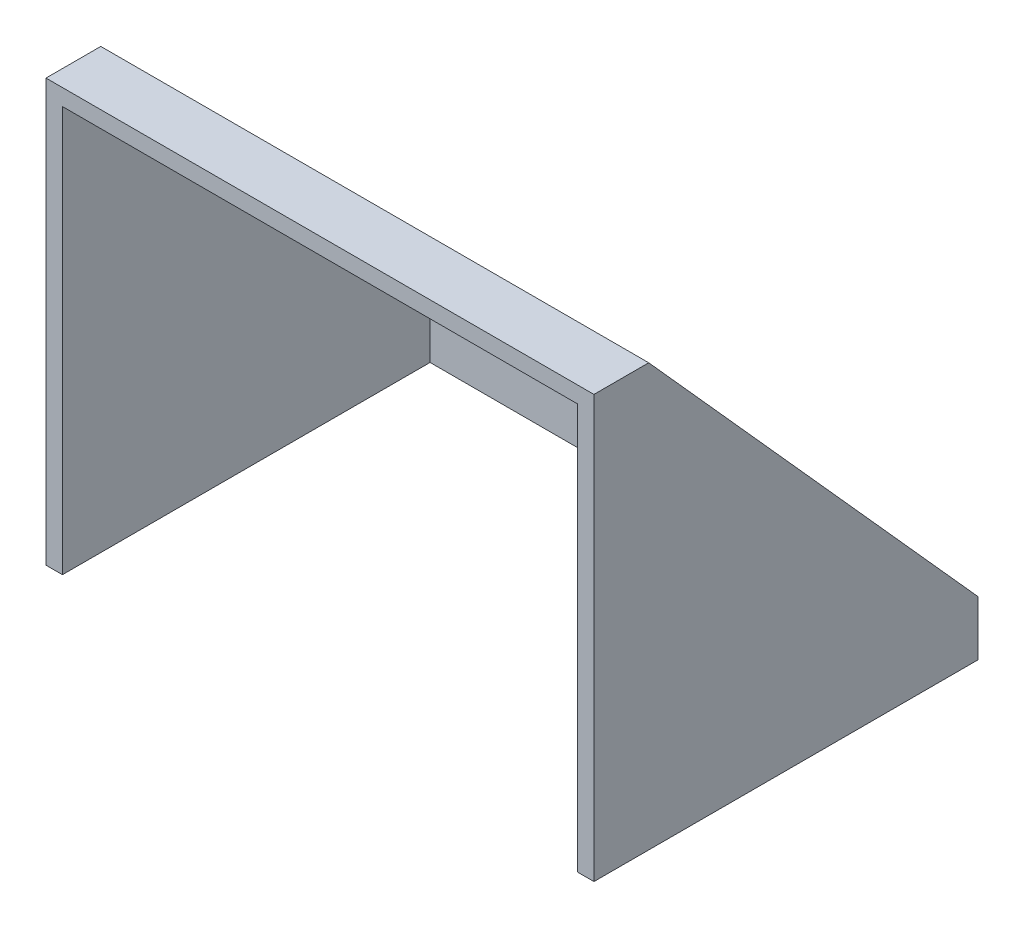
from build123d import *

# Parameters (mm, degrees)
RESSALTO_EXTRUS_O1_DEPTH = 50
CASCA1_T                 = -3
ESBO_O4_R                = 1.6
ESBO_O4_R_2              = 5
ESBO_O4_R_3              = 3
ESBO_O4_R_4              = 2.5
ESBO_O4_W                = 79
ESBO_O4_H                = 51.6
CORTE_EXTRUS_O1_DEPTH    = 3


with BuildPart() as part:
    # Esboço2 → Ressalto-extrusão1 (new, symmetric)
    with BuildSketch(Plane(origin=(0, 0, 0), x_dir=(0, 0, -1), z_dir=(1, 0, 0))):
        Polygon((0, 0), (70.09159675, 0), (70.09159675, 10), (10, 77), (0, 77), align=None)
    extrude(amount=RESSALTO_EXTRUS_O1_DEPTH, both=True)

    # Casca1
    casca1_openings = [part.faces().sort_by_distance(p)[0] for p in [
        (0, 0, -35.045798375),
        (0, 38.5, 0),
    ]]
    offset(amount=CASCA1_T, openings=casca1_openings, kind=Kind.INTERSECTION)

    # Esboço4 → Corte-extrusão1 (cut)
    with BuildSketch(Plane(origin=(0, 39.297329608, -43.815129338), x_dir=(1, 0, 0), z_dir=(0, 0.6676844083366051, -0.7444444444444445))):
        with Locations(Location((-44, 19.854621861, 0), (0, 0, 270))):
            Circle(ESBO_O4_R)
        with Locations(Location((-44, -45.145378139, 0), (0, 0, 270))):
            Circle(ESBO_O4_R)
        with Locations(Location((44, -45.145378139, 0), (0, 0, 270))):
            Circle(ESBO_O4_R)
        with Locations(Location((44, 19.854621861, 0), (0, 0, 270))):
            Circle(ESBO_O4_R)
        with Locations(Location((-37.5, 30.654621861, 0), (0, 0, 270))):
            Circle(ESBO_O4_R_2)
        with Locations(Location((36.75, 28.054621861, 0), (0, 0, 270))):
            Circle(ESBO_O4_R_3)
        with Locations(Location((-3.8, 31.054621861, 0), (0, 0, 270))):
            Circle(ESBO_O4_R_4)
        with Locations((0, -12.845378139)):
            Rectangle(ESBO_O4_W, ESBO_O4_H)
    extrude(amount=-CORTE_EXTRUS_O1_DEPTH, mode=Mode.SUBTRACT)


solid = part.part
